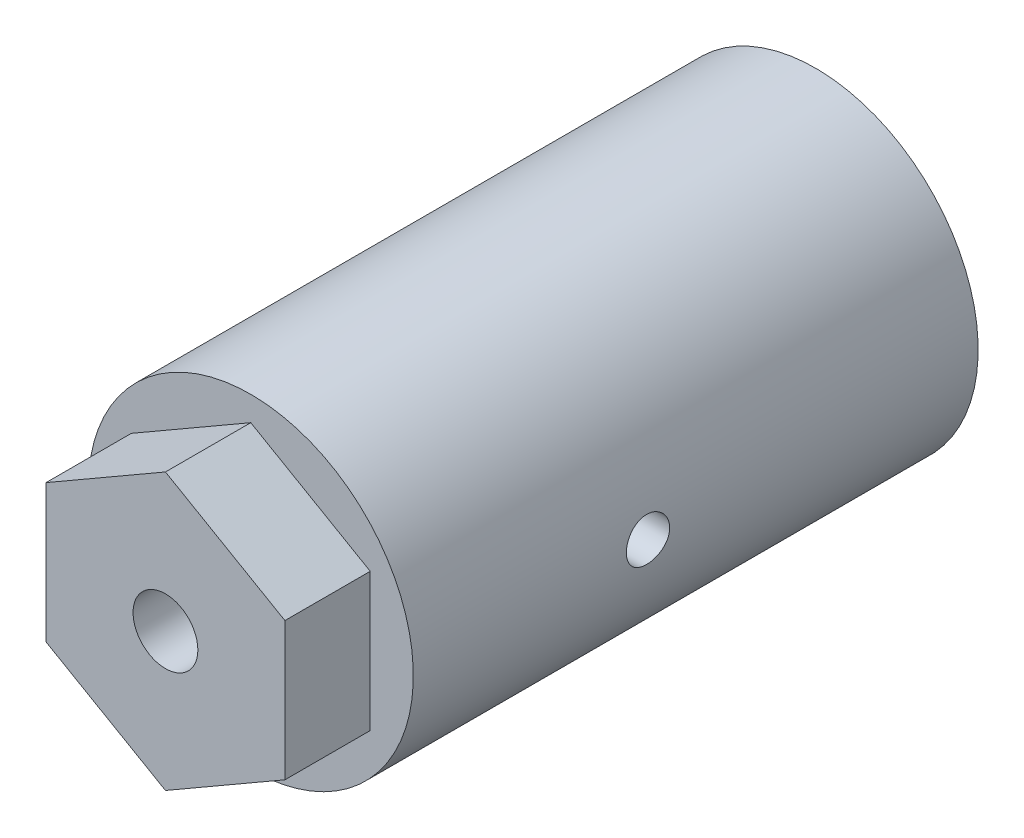
from build123d import *

# Parameters (mm, degrees)
BOSS_EXTRUDE2_DEPTH        = 5
SKETCH2_R                  = 9.525
BOSS_EXTRUDE3_DEPTH        = 33.1
SKETCH3_R                  = 3.96875
CUT_EXTRUDE1_DEPTH         = 19.05
SKETCH4_R                  = 1.27
CUT_EXTRUDE2_DEPTH         = 19.05
F_10_24_TAPPED_HOLE1_D     = 3.7973
F_10_24_TAPPED_HOLE1_DEPTH = 14.95
F_10_24_TAPPED_HOLE1_TIP   = 1.140824014
SKETCH6_R                  = 1.27
CUT_EXTRUDE3_DEPTH         = 8


with BuildPart() as part:
    # Sketch1 → Boss-Extrude2 (new body)
    with BuildSketch(Plane.XY):
        Polygon((0, 8.082903769), (-7, 4.041451884), (-7, -4.041451884), (0, -8.082903769), (7, -4.041451884), (7, 4.041451884), align=None)
    extrude(amount=BOSS_EXTRUDE2_DEPTH)

    # Sketch2 → Boss-Extrude3 (add)
    with BuildSketch(Plane(origin=(0, 0, 0), x_dir=(-1, 0, 0), z_dir=(0, 0, -1))):
        Circle(SKETCH2_R)
    extrude(amount=BOSS_EXTRUDE3_DEPTH)

    # Sketch3 → Cut-Extrude1 (cut)
    with BuildSketch(Plane(origin=(0, 0, -33.1), x_dir=(-1, 0, 0), z_dir=(0, 0, -1))):
        Circle(SKETCH3_R)
    extrude(amount=-CUT_EXTRUDE1_DEPTH, mode=Mode.SUBTRACT)

    # Sketch4 → Cut-Extrude2 (cut)
    with BuildSketch(Plane.XY.offset(5)):
        Circle(SKETCH4_R)
    extrude(amount=-CUT_EXTRUDE2_DEPTH, mode=Mode.SUBTRACT)

    # #10-24 Tapped Hole1
    with Locations(Plane.XY.offset(5)):
        with Locations((0, 0)):
            Hole(F_10_24_TAPPED_HOLE1_D / 2, depth=F_10_24_TAPPED_HOLE1_DEPTH)
            with Locations((0, 0, -(F_10_24_TAPPED_HOLE1_DEPTH + F_10_24_TAPPED_HOLE1_TIP / 2))):  # 118° drill point
                Cone(0, F_10_24_TAPPED_HOLE1_D / 2, F_10_24_TAPPED_HOLE1_TIP, mode=Mode.SUBTRACT)

    # Sketch6 → Cut-Extrude3 (cut)
    with BuildSketch(Plane(origin=(9.525, 0, 0), x_dir=(0, 0, -1), z_dir=(1, 0, 0))):
        with Locations((13.755140778, 0)):
            Circle(SKETCH6_R)
    extrude(amount=-CUT_EXTRUDE3_DEPTH, mode=Mode.SUBTRACT)


solid = part.part
